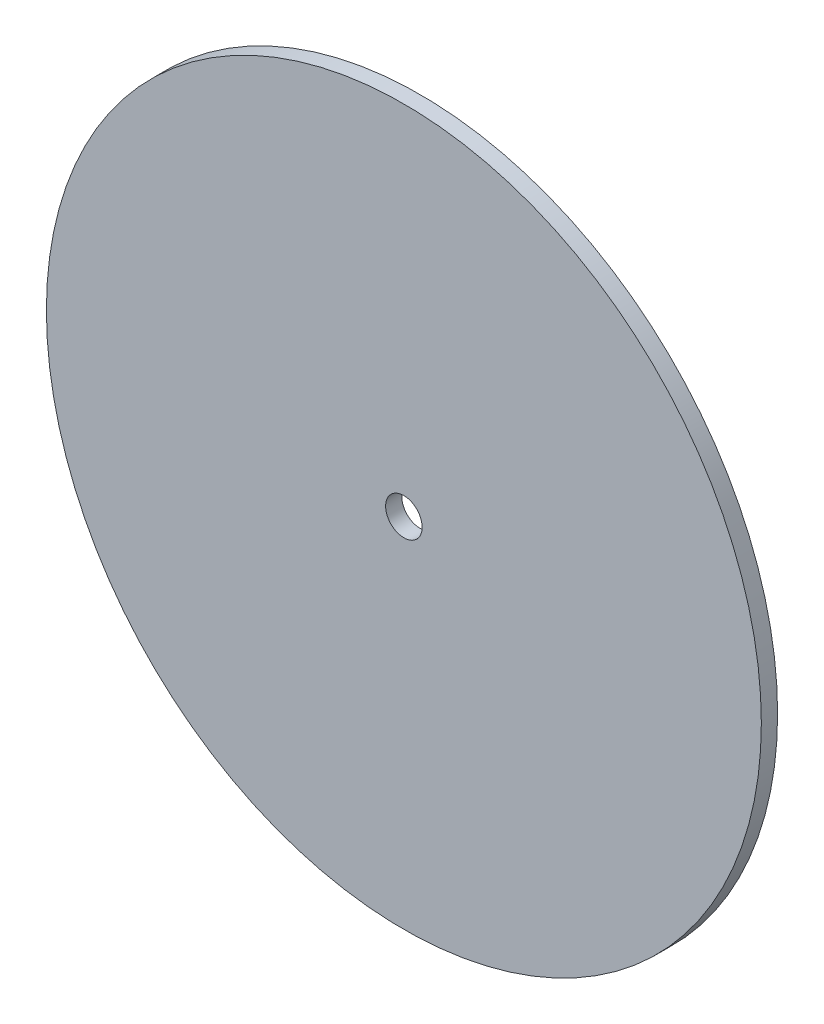
from build123d import *

# Parameters (mm, degrees)
SKETCH2_R           = 279.4
SKETCH2_R_2         = 14.2875
BOSS_EXTRUDE1_DEPTH = 12.7


with BuildPart() as part:
    # Sketch2 → Boss-Extrude1 (new body)
    with BuildSketch(Plane.XY):
        Circle(SKETCH2_R)
        Circle(SKETCH2_R_2, mode=Mode.SUBTRACT)
    extrude(amount=BOSS_EXTRUDE1_DEPTH)


solid = part.part
